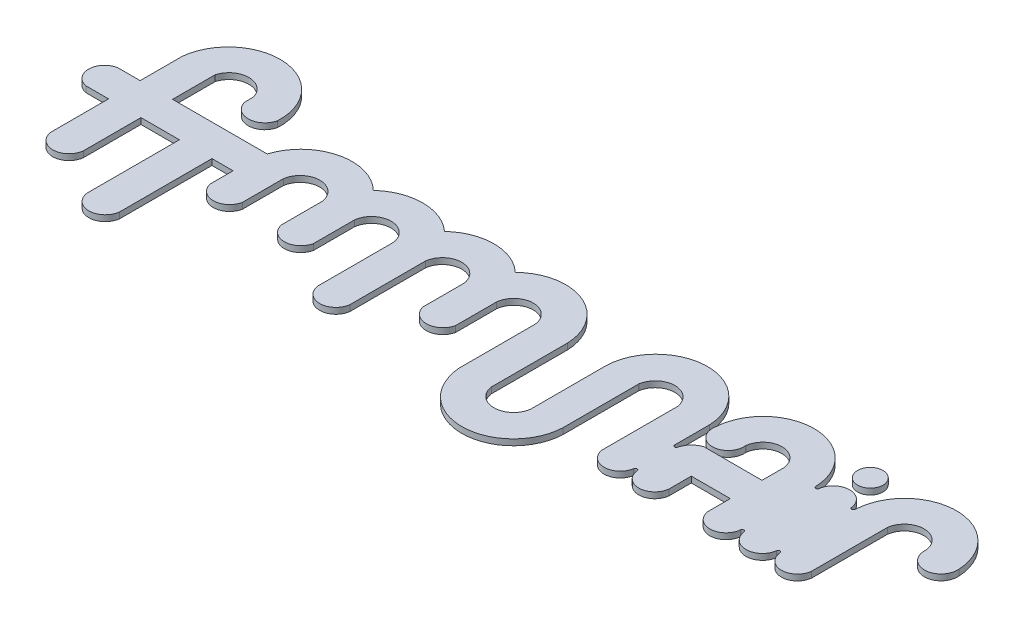
from build123d import *

# Parameters (mm, degrees)
SKETCH1_R             = 1.209251999
BOSS_EXTRUDE1_DEPTH   = 0.5
BOSS_EXTRUDE1_2_DEPTH = 0.5
CUT_EXTRUDE1_START    = -10
SKETCH2_R             = 1.209251999
SKETCH2_R_2           = 1.059251999
CUT_EXTRUDE1_DEPTH    = 10


with BuildPart() as part:
    # Sketch1 → Boss-Extrude1 (new body)
    with BuildSketch(Plane(origin=(0, 0, 0), x_dir=(1, 0, 0), z_dir=(0, 1, 0))):
        with Locations(Location((-57.769460136, 21.444621451, 0), (0, 0, 270))):
            Circle(SKETCH1_R)
    extrude(amount=BOSS_EXTRUDE1_DEPTH)


with BuildPart() as body_2:
    # Sketch1 → Boss-Extrude1 2 (new body)
    with BuildSketch(Plane(origin=(0, 0, 0), x_dir=(1, 0, 0), z_dir=(0, 1, 0))):
        with BuildLine():
            Line((-116.99464605, 16.900740614), (-116.99464605, 12.250218127))
            ThreePointArc((-116.99464605, 12.250218127), (-115.494477506, 10.900066437), (-113.994308962, 12.250218127))
            Line((-113.994308962, 12.250218127), (-113.994308962, 16.900740614))
            Line((-113.994308962, 16.900740614), (-111.08954668, 16.900740614))
            Line((-111.08954668, 16.900740614), (-111.08954668, 9.356838959))
            ThreePointArc((-111.08954668, 9.356838959), (-109.583434439, 8.000473522), (-108.077322198, 9.356838959))
            Line((-108.077322198, 9.356838959), (-108.077322198, 16.900740614))
            Line((-108.077322198, 16.900740614), (-106.619579771, 16.900740614))
            Line((-106.619579771, 16.900740614), (-106.619579771, 15.136957189))
            ThreePointArc((-106.619579771, 15.136957189), (-105.135495695, 13.917305566), (-103.651411619, 15.136957189))
            Line((-103.651411619, 15.136957189), (-103.651411619, 18.56300271))
            ThreePointArc((-103.651411619, 18.56300271), (-102.175447813, 19.834993444), (-100.699484006, 18.56300271))
            Line((-100.699484006, 18.56300271), (-100.699484006, 15.136957189))
            ThreePointArc((-100.699484006, 15.136957189), (-99.208127539, 13.914215368), (-97.716771072, 15.136957189))
            Line((-97.716771072, 15.136957189), (-97.716771072, 18.56300271))
            ThreePointArc((-97.716771072, 18.56300271), (-96.245289523, 19.848230468), (-94.773807974, 18.56300271))
            Line((-94.773807974, 18.56300271), (-94.773807974, 12.250218127))
            ThreePointArc((-94.773807974, 12.250218127), (-93.283431352, 10.930801959), (-91.793054731, 12.250218127))
            Line((-91.793054731, 12.250218127), (-91.793054731, 18.56300271))
            ThreePointArc((-91.793054731, 18.56300271), (-90.338893982, 19.825489802), (-88.884733233, 18.56300271))
            Line((-88.884733233, 18.56300271), (-88.884733233, 15.136957189))
            ThreePointArc((-88.884733233, 15.136957189), (-87.382237001, 13.913018333), (-85.879740768, 15.136957189))
            Line((-85.879740768, 15.136957189), (-85.879740768, 18.56300271))
            ThreePointArc((-85.879740768, 18.56300271), (-84.421762943, 19.863544717), (-82.963785118, 18.56300271))
            Line((-82.963785118, 18.56300271), (-82.963785118, 12.250218127))
            ThreePointArc((-82.963785118, 12.250218127), (-82.883279485, 11.616611092), (-82.702472023, 11.004036449))
            ThreePointArc((-82.702472023, 11.004036449), (-77.851116297, 8.018259078), (-74.03784454, 12.250218127))
            Line((-74.03784454, 12.250218127), (-74.03784454, 18.56300271))
            ThreePointArc((-74.03784454, 18.56300271), (-72.567820129, 19.813721424), (-71.097795718, 18.56300271))
            Line((-71.097795718, 18.56300271), (-71.097795718, 12.250218127))
            ThreePointArc((-71.097795718, 12.250218127), (-69.637000134, 10.963463673), (-68.140595422, 12.208627799))
            ThreePointArc((-68.140595422, 12.208627799), (-66.650784409, 10.90983005), (-65.198278901, 12.250218127))
            Line((-65.198278901, 12.250218127), (-65.198278901, 13.958232408))
            Line((-65.198278901, 13.958232408), (-62.248100019, 13.958232408))
            Line((-62.248100019, 13.958232408), (-62.248100019, 12.250218127))
            ThreePointArc((-62.248100019, 12.250218127), (-60.760250184, 10.920546827), (-59.272400349, 12.250218127))
            ThreePointArc((-59.272400349, 12.250218127), (-57.769460136, 10.939414499), (-56.266519924, 12.250218127))
            ThreePointArc((-56.266519924, 12.250218127), (-54.795785573, 10.919193219), (-53.325051222, 12.250218127))
            Line((-53.325051222, 12.250218127), (-53.325051222, 18.56300271))
            ThreePointArc((-53.325051222, 18.56300271), (-51.854316871, 19.850297235), (-50.38358252, 18.56300271))
            ThreePointArc((-50.38358252, 18.56300271), (-48.859171733, 16.896229088), (-47.334760946, 18.56300271))
            ThreePointArc((-47.334760946, 18.56300271), (-51.800640435, 22.80820453), (-56.266519924, 18.56300271))
            ThreePointArc((-56.266519924, 18.56300271), (-57.769460136, 19.871423627), (-59.272400349, 18.56300271))
            ThreePointArc((-59.272400349, 18.56300271), (-63.66346233, 22.805553938), (-68.05452431, 18.56300271))
            ThreePointArc((-68.05452431, 18.56300271), (-66.592863995, 16.954711471), (-65.13120368, 18.56300271))
            ThreePointArc((-65.13120368, 18.56300271), (-63.689651849, 19.85727213), (-62.248100019, 18.56300271))
            Line((-62.248100019, 18.56300271), (-62.248100019, 16.900740614))
            Line((-62.248100019, 16.900740614), (-66.958866007, 16.900740614))
            ThreePointArc((-66.958866007, 16.900740614), (-67.710582518, 16.446976526), (-68.140595422, 15.681425442))
            Line((-68.140595422, 15.681425442), (-68.140595422, 18.56300271))
            ThreePointArc((-68.140595422, 18.56300271), (-72.580586611, 22.843308976), (-77.0205778, 18.56300271))
            Line((-77.0205778, 18.56300271), (-77.0205778, 12.250218127))
            ThreePointArc((-77.0205778, 12.250218127), (-78.179656219, 10.99925818), (-79.755890288, 11.650295606))
            ThreePointArc((-79.755890288, 11.650295606), (-79.888366212, 11.939763856), (-79.958792654, 12.250218127))
            Line((-79.958792654, 12.250218127), (-79.958792654, 18.56300271))
            ThreePointArc((-79.958792654, 18.56300271), (-82.672334819, 22.49858506), (-87.382237001, 21.680696957))
            ThreePointArc((-87.382237001, 21.680696957), (-90.332834176, 22.803111884), (-93.283431352, 21.680696957))
            ThreePointArc((-93.283431352, 21.680696957), (-96.245779446, 22.785939283), (-99.208127539, 21.680696957))
            ThreePointArc((-99.208127539, 21.680696957), (-103.284986599, 22.690454276), (-106.365040669, 19.834993444))
            Line((-106.365040669, 19.834993444), (-106.619579771, 19.834993444))
            Line((-106.619579771, 19.834993444), (-113.994308962, 19.834993444))
            Line((-113.994308962, 19.834993444), (-113.994308962, 23.214055484))
            ThreePointArc((-113.994308962, 23.214055484), (-112.528239221, 24.294227528), (-111.08954668, 23.177851291))
            Line((-111.08954668, 23.177851291), (-111.08954668, 22.49858506))
            ThreePointArc((-111.08954668, 22.49858506), (-109.583434439, 21.277340516), (-108.077322198, 22.49858506))
            ThreePointArc((-108.077322198, 22.49858506), (-112.188236075, 27.19050638), (-116.99464605, 23.214055484))
            Line((-116.99464605, 23.214055484), (-116.99464605, 19.834993444))
            Line((-116.99464605, 19.834993444), (-118.730201095, 19.834993444))
            ThreePointArc((-118.730201095, 19.834993444), (-119.973492356, 18.367867029), (-118.730201095, 16.900740614))
            Line((-118.730201095, 16.900740614), (-116.99464605, 16.900740614))
        make_face()
    extrude(amount=BOSS_EXTRUDE1_2_DEPTH)


with BuildPart() as cut_extrude1_tool:
    # Sketch2 → Cut-Extrude1 (new body)
    # profile 1 of 2: a face of its own
    with BuildSketch(Plane(origin=(0, 0.5, 0), x_dir=(1, 0, 0), z_dir=(0, 1, 0)).offset(CUT_EXTRUDE1_START)):
        with BuildLine():
            ThreePointArc((-118.730201095, 19.834993444), (-119.973492356, 18.367867029), (-118.730201095, 16.900740614))
            Line((-118.730201095, 16.900740614), (-116.99464605, 16.900740614))
            Line((-116.99464605, 16.900740614), (-116.99464605, 12.250218127))
            ThreePointArc((-116.99464605, 12.250218127), (-115.494477506, 10.900066437), (-113.994308962, 12.250218127))
            Line((-113.994308962, 12.250218127), (-113.994308962, 16.900740614))
            Line((-113.994308962, 16.900740614), (-111.08954668, 16.900740614))
            Line((-111.08954668, 16.900740614), (-111.08954668, 9.356838959))
            ThreePointArc((-111.08954668, 9.356838959), (-109.583434439, 8.000473522), (-108.077322198, 9.356838959))
            Line((-108.077322198, 9.356838959), (-108.077322198, 16.900740614))
            Line((-108.077322198, 16.900740614), (-106.619579771, 16.900740614))
            Line((-106.619579771, 16.900740614), (-106.619579771, 15.136957189))
            ThreePointArc((-106.619579771, 15.136957189), (-105.135495695, 13.917305566), (-103.651411619, 15.136957189))
            Line((-103.651411619, 15.136957189), (-103.651411619, 18.56300271))
            ThreePointArc((-103.651411619, 18.56300271), (-102.175447813, 19.834993444), (-100.699484006, 18.56300271))
            Line((-100.699484006, 18.56300271), (-100.699484006, 15.136957189))
            ThreePointArc((-100.699484006, 15.136957189), (-99.208127539, 13.914215368), (-97.716771072, 15.136957189))
            Line((-97.716771072, 15.136957189), (-97.716771072, 18.56300271))
            ThreePointArc((-97.716771072, 18.56300271), (-96.245289523, 19.848230468), (-94.773807974, 18.56300271))
            Line((-94.773807974, 18.56300271), (-94.773807974, 12.250218127))
            ThreePointArc((-94.773807974, 12.250218127), (-93.283431352, 10.930801959), (-91.793054731, 12.250218127))
            Line((-91.793054731, 12.250218127), (-91.793054731, 18.56300271))
            ThreePointArc((-91.793054731, 18.56300271), (-90.338893982, 19.825489802), (-88.884733233, 18.56300271))
            Line((-88.884733233, 18.56300271), (-88.884733233, 15.136957189))
            ThreePointArc((-88.884733233, 15.136957189), (-87.382237001, 13.913018333), (-85.879740768, 15.136957189))
            Line((-85.879740768, 15.136957189), (-85.879740768, 18.56300271))
            ThreePointArc((-85.879740768, 18.56300271), (-84.421762943, 19.863544717), (-82.963785118, 18.56300271))
            Line((-82.963785118, 18.56300271), (-82.963785118, 12.250218127))
            ThreePointArc((-82.963785118, 12.250218127), (-82.883279485, 11.616611092), (-82.702472023, 11.004036449))
            ThreePointArc((-82.702472023, 11.004036449), (-77.851116297, 8.018259078), (-74.03784454, 12.250218127))
            Line((-74.03784454, 12.250218127), (-74.03784454, 18.56300271))
            ThreePointArc((-74.03784454, 18.56300271), (-72.567820129, 19.813721424), (-71.097795718, 18.56300271))
            Line((-71.097795718, 18.56300271), (-71.097795718, 12.250218127))
            ThreePointArc((-71.097795718, 12.250218127), (-69.637000134, 10.963463673), (-68.140595422, 12.208627799))
            ThreePointArc((-68.140595422, 12.208627799), (-66.650784409, 10.90983005), (-65.198278901, 12.250218127))
            Line((-65.198278901, 12.250218127), (-65.198278901, 13.958232408))
            Line((-65.198278901, 13.958232408), (-62.248100019, 13.958232408))
            Line((-62.248100019, 13.958232408), (-62.248100019, 12.250218127))
            ThreePointArc((-62.248100019, 12.250218127), (-60.760250184, 10.920546827), (-59.272400349, 12.250218127))
            ThreePointArc((-59.272400349, 12.250218127), (-57.769460136, 10.939414499), (-56.266519924, 12.250218127))
            ThreePointArc((-56.266519924, 12.250218127), (-54.795785573, 10.919193219), (-53.325051222, 12.250218127))
            Line((-53.325051222, 12.250218127), (-53.325051222, 18.56300271))
            ThreePointArc((-53.325051222, 18.56300271), (-51.854316871, 19.850297235), (-50.38358252, 18.56300271))
            ThreePointArc((-50.38358252, 18.56300271), (-48.859171733, 16.896229088), (-47.334760946, 18.56300271))
            ThreePointArc((-47.334760946, 18.56300271), (-51.800640435, 22.80820453), (-56.266519924, 18.56300271))
            ThreePointArc((-56.266519924, 18.56300271), (-57.769460136, 19.871423627), (-59.272400349, 18.56300271))
            ThreePointArc((-59.272400349, 18.56300271), (-63.66346233, 22.805553938), (-68.05452431, 18.56300271))
            ThreePointArc((-68.05452431, 18.56300271), (-66.592863995, 16.954711471), (-65.13120368, 18.56300271))
            ThreePointArc((-65.13120368, 18.56300271), (-63.689651849, 19.85727213), (-62.248100019, 18.56300271))
            Line((-62.248100019, 18.56300271), (-62.248100019, 16.900740614))
            Line((-62.248100019, 16.900740614), (-66.958866007, 16.900740614))
            ThreePointArc((-66.958866007, 16.900740614), (-67.710582518, 16.446976526), (-68.140595422, 15.681425442))
            Line((-68.140595422, 15.681425442), (-68.140595422, 18.56300271))
            ThreePointArc((-68.140595422, 18.56300271), (-72.580586611, 22.843308976), (-77.0205778, 18.56300271))
            Line((-77.0205778, 18.56300271), (-77.0205778, 12.250218127))
            ThreePointArc((-77.0205778, 12.250218127), (-78.179656219, 10.99925818), (-79.755890288, 11.650295606))
            ThreePointArc((-79.755890288, 11.650295606), (-79.888366212, 11.939763856), (-79.958792654, 12.250218127))
            Line((-79.958792654, 12.250218127), (-79.958792654, 18.56300271))
            ThreePointArc((-79.958792654, 18.56300271), (-82.672334819, 22.49858506), (-87.382237001, 21.680696957))
            ThreePointArc((-87.382237001, 21.680696957), (-90.332834176, 22.803111884), (-93.283431352, 21.680696957))
            ThreePointArc((-93.283431352, 21.680696957), (-96.245779446, 22.785939283), (-99.208127539, 21.680696957))
            ThreePointArc((-99.208127539, 21.680696957), (-103.284986599, 22.690454276), (-106.365040669, 19.834993444))
            Line((-106.365040669, 19.834993444), (-113.994308962, 19.834993444))
            Line((-113.994308962, 19.834993444), (-113.994308962, 23.214055484))
            ThreePointArc((-113.994308962, 23.214055484), (-112.528239221, 24.294227528), (-111.08954668, 23.177851291))
            Line((-111.08954668, 23.177851291), (-111.08954668, 22.49858506))
            ThreePointArc((-111.08954668, 22.49858506), (-109.583434439, 21.277340516), (-108.077322198, 22.49858506))
            ThreePointArc((-108.077322198, 22.49858506), (-112.188236075, 27.19050638), (-116.99464605, 23.214055484))
            Line((-116.99464605, 23.214055484), (-116.99464605, 19.834993444))
            Line((-116.99464605, 19.834993444), (-118.730201095, 19.834993444))
        make_face()
        with BuildLine():
            Line((-65.348278901, 14.108232408), (-65.348278901, 12.257491445))
            ThreePointArc((-65.348278901, 12.257491445), (-66.656351649, 11.059770809), (-67.991722188, 12.226978827))
            ThreePointArc((-67.991722188, 12.226978827), (-68.136676287, 12.378768324), (-68.288465784, 12.233814225))
            ThreePointArc((-68.288465784, 12.233814225), (-69.629749261, 11.113386348), (-70.947795718, 12.261059441))
            Line((-70.947795718, 12.261059441), (-70.947795718, 18.56300271))
            Line((-70.947795718, 18.56300271), (-70.949732289, 18.587028134))
            ThreePointArc((-70.949732289, 18.587028134), (-72.567820129, 19.963721424), (-74.185907968, 18.587028134))
            Line((-74.185907968, 18.587028134), (-74.18784454, 18.56300271))
            Line((-74.18784454, 18.56300271), (-74.18784454, 12.253157606))
            ThreePointArc((-74.18784454, 12.253157606), (-77.875490204, 8.166298078), (-82.561325798, 11.054912992))
            ThreePointArc((-82.561325798, 11.054912992), (-82.735790785, 11.64415192), (-82.813785118, 12.253707029))
            Line((-82.813785118, 12.253707029), (-82.813785118, 18.571354702))
            ThreePointArc((-82.813785118, 18.571354702), (-84.421762943, 20.013544717), (-86.029740768, 18.571354702))
            Line((-86.029740768, 18.571354702), (-86.029740768, 15.152680994))
            ThreePointArc((-86.029740768, 15.152680994), (-87.382237001, 14.063018333), (-88.734733233, 15.152680994))
            Line((-88.734733233, 15.152680994), (-88.734733233, 18.57332753))
            ThreePointArc((-88.734733233, 18.57332753), (-90.338893982, 19.975489802), (-91.943054731, 18.57332753))
            Line((-91.943054731, 18.57332753), (-91.943054731, 12.259585837))
            ThreePointArc((-91.943054731, 12.259585837), (-93.283431352, 11.080801959), (-94.623807974, 12.259585837))
            Line((-94.623807974, 12.259585837), (-94.623807974, 18.572892458))
            ThreePointArc((-94.623807974, 18.572892458), (-96.245289523, 19.998230468), (-97.866771072, 18.572892458))
            Line((-97.866771072, 18.572892458), (-97.866771072, 15.152191979))
            ThreePointArc((-97.866771072, 15.152191979), (-99.208127539, 14.064215368), (-100.549484006, 15.152191979))
            Line((-100.549484006, 15.152191979), (-100.549484006, 18.573868847))
            ThreePointArc((-100.549484006, 18.573868847), (-102.175447813, 19.984993444), (-103.801411619, 18.573868847))
            Line((-103.801411619, 18.573868847), (-103.801411619, 15.152014344))
            ThreePointArc((-103.801411619, 15.152014344), (-105.135495695, 14.067305566), (-106.469579771, 15.152014344))
            Line((-106.469579771, 15.152014344), (-106.469579771, 17.050740614))
            Line((-106.469579771, 17.050740614), (-108.227322198, 17.050740614))
            Line((-108.227322198, 17.050740614), (-108.227322198, 9.364891181))
            ThreePointArc((-108.227322198, 9.364891181), (-109.583434439, 8.150473522), (-110.93954668, 9.364891181))
            Line((-110.93954668, 9.364891181), (-110.93954668, 17.050740614))
            Line((-110.93954668, 17.050740614), (-114.144308962, 17.050740614))
            Line((-114.144308962, 17.050740614), (-114.144308962, 12.258320133))
            ThreePointArc((-114.144308962, 12.258320133), (-115.494477506, 11.050066437), (-116.84464605, 12.258320133))
            Line((-116.84464605, 12.258320133), (-116.84464605, 17.050740614))
            Line((-116.84464605, 17.050740614), (-118.717482081, 17.050740614))
            ThreePointArc((-118.717482081, 17.050740614), (-119.823492356, 18.367867029), (-118.717482081, 19.684993444))
            Line((-118.717482081, 19.684993444), (-116.84464605, 19.684993444))
            Line((-116.84464605, 19.684993444), (-116.84464605, 23.205849963))
            ThreePointArc((-116.84464605, 23.205849963), (-112.202171454, 27.041141994), (-108.226519377, 22.518286048))
            ThreePointArc((-108.226519377, 22.518286048), (-109.581576727, 21.427341758), (-110.93954668, 22.514658397))
            Line((-110.93954668, 22.514658397), (-110.93954668, 23.197245398))
            ThreePointArc((-110.93954668, 23.197245398), (-112.527343771, 24.444227732), (-114.144308962, 23.235307506))
            Line((-114.144308962, 23.235307506), (-114.144308962, 19.684993444))
            Line((-114.144308962, 19.684993444), (-106.256226051, 19.684993444))
            ThreePointArc((-106.256226051, 19.684993444), (-103.233917652, 22.548692827), (-99.21058265, 21.477292958))
            ThreePointArc((-99.21058265, 21.477292958), (-96.246549024, 22.635939215), (-93.282107735, 21.478336378))
            ThreePointArc((-93.282107735, 21.478336378), (-90.330897311, 22.653111446), (-87.380749007, 21.475671677))
            ThreePointArc((-87.380749007, 21.475671677), (-82.795143663, 22.386850585), (-80.108792654, 18.56042384))
            Line((-80.108792654, 18.56042384), (-80.108792654, 12.241415598))
            ThreePointArc((-80.108792654, 12.241415598), (-80.031462218, 11.894680427), (-79.883644575, 11.571639843))
            ThreePointArc((-79.883644575, 11.571639843), (-78.143713833, 10.853580593), (-76.8705778, 12.239976176))
            Line((-76.8705778, 12.239976176), (-76.8705778, 18.560232339))
            ThreePointArc((-76.8705778, 18.560232339), (-72.580586611, 22.693308976), (-68.290595422, 18.560232339))
            Line((-68.290595422, 18.560232339), (-68.290595422, 15.681425442))
            ThreePointArc((-68.290595422, 15.681425442), (-68.161831452, 15.514995494), (-67.995401503, 15.643759464))
            ThreePointArc((-67.995401503, 15.643759464), (-67.61016894, 16.335001225), (-66.936833912, 16.750740614))
            Line((-66.936833912, 16.750740614), (-62.098100019, 16.750740614))
            Line((-62.098100019, 16.750740614), (-62.098100019, 18.570878683))
            ThreePointArc((-62.098100019, 18.570878683), (-63.685515177, 20.007266782), (-65.280336737, 18.579106481))
            Line((-65.280336737, 18.579106481), (-65.280520839, 18.548706344))
            ThreePointArc((-65.280520839, 18.548706344), (-66.592863995, 17.104711471), (-67.905207152, 18.548706344))
            Line((-67.905207152, 18.548706344), (-67.904613051, 18.557843798))
            ThreePointArc((-67.904613051, 18.557843798), (-63.66346233, 22.655553938), (-59.422311608, 18.557843798))
            ThreePointArc((-59.422311608, 18.557843798), (-59.280820315, 18.400853184), (-59.123829701, 18.542344477))
            ThreePointArc((-59.123829701, 18.542344477), (-57.769460136, 19.721423627), (-56.415090571, 18.542344477))
            ThreePointArc((-56.415090571, 18.542344477), (-56.259369844, 18.399686962), (-56.116712328, 18.55540769))
            ThreePointArc((-56.116712328, 18.55540769), (-51.800640435, 22.65820453), (-47.484568542, 18.55540769))
            Line((-47.484568542, 18.55540769), (-47.484165082, 18.549645907))
            ThreePointArc((-47.484165082, 18.549645907), (-48.867114311, 17.046251937), (-50.232672877, 18.56545956))
            ThreePointArc((-50.232672877, 18.56545956), (-51.850649225, 20.000293119), (-53.475051222, 18.572738232))
            Line((-53.475051222, 18.572738232), (-53.475051222, 12.257898442))
            ThreePointArc((-53.475051222, 12.257898442), (-54.799425661, 11.069198208), (-56.117264026, 12.265140492))
            ThreePointArc((-56.117264026, 12.265140492), (-56.263461761, 12.416806294), (-56.415127562, 12.270608559))
            ThreePointArc((-56.415127562, 12.270608559), (-57.769460136, 11.089414499), (-59.12379271, 12.270608559))
            ThreePointArc((-59.12379271, 12.270608559), (-59.274425762, 12.417640571), (-59.421457775, 12.267007519))
            ThreePointArc((-59.421457775, 12.267007519), (-60.756150352, 11.070553065), (-62.098100019, 12.258862211))
            Line((-62.098100019, 12.258862211), (-62.098100019, 14.108232408))
            Line((-62.098100019, 14.108232408), (-65.348278901, 14.108232408))
        make_face(mode=Mode.SUBTRACT)
    # profile 2 of 2: a face of its own
    with BuildSketch(Plane(origin=(0, 0.5, 0), x_dir=(1, 0, 0), z_dir=(0, 1, 0)).offset(CUT_EXTRUDE1_START)):
        with Locations((-57.769460136, 21.444621451)):
            Circle(SKETCH2_R)
        with Locations(Location((-57.769460136, 21.444621451, 0), (0, 0, 270))):
            Circle(SKETCH2_R_2, mode=Mode.SUBTRACT)
    extrude(amount=CUT_EXTRUDE1_DEPTH)


with BuildPart() as part_1:
    add(part.part)

    # Cut-Extrude1: cut by cut_extrude1_tool
    add(cut_extrude1_tool.part, mode=Mode.SUBTRACT)


with BuildPart() as body_2_1:
    add(body_2.part)

    # Cut-Extrude1: cut by cut_extrude1_tool
    add(cut_extrude1_tool.part, mode=Mode.SUBTRACT)


solid = Compound([part_1.part, body_2_1.part])
